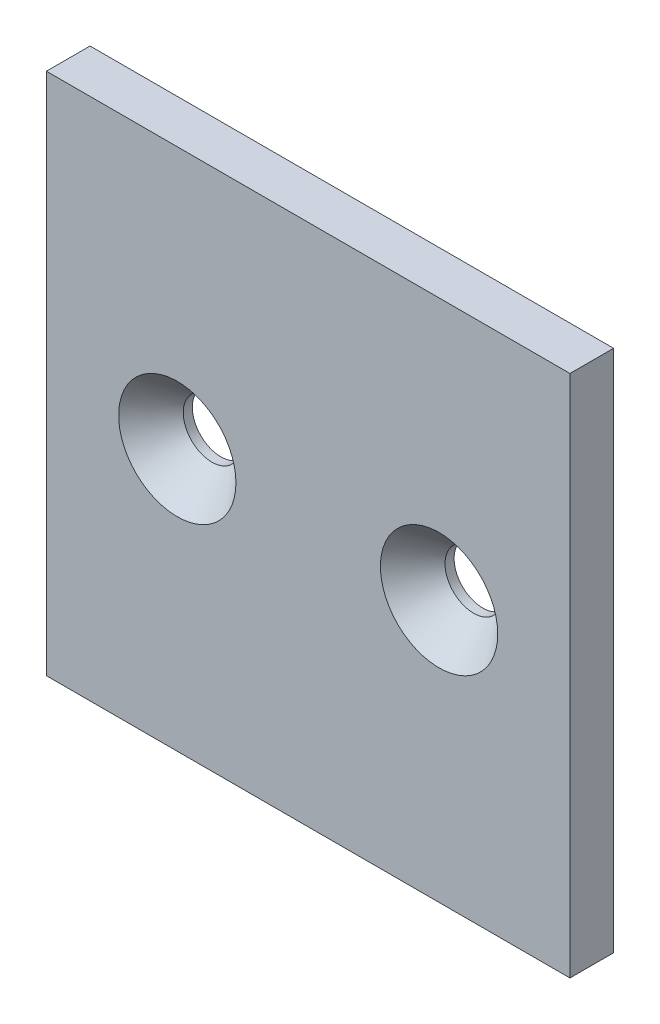
from build123d import *

# Parameters (mm, degrees)
SKETCH1_W                    = 76.2
SKETCH1_H                    = 76.2
SKETCH1_R                    = 4.1656
BOSS_EXTRUDE1_DEPTH          = 3.175
CUT_EXTRUDE1_START           = -5.0292
SKETCH2_R                    = 4.1656
CUT_EXTRUDE1_DEPTH           = 113.9792
CUT_EXTRUDE1_DRAFT           = -41
CUT_EXTRUDE1_PROFILE_2_DEPTH = 113.9792
CUT_EXTRUDE1_PROFILE_2_DRAFT = -41


with BuildPart() as part:
    # Sketch1 → Boss-Extrude1 (new, symmetric)
    with BuildSketch(Plane.XY):
        with Locations((38.1, 38.1)):
            Rectangle(SKETCH1_W, SKETCH1_H)
        with Locations((19.05, 38.1)):
            Circle(SKETCH1_R, mode=Mode.SUBTRACT)
        with Locations((57.15, 38.1)):
            Circle(SKETCH1_R, mode=Mode.SUBTRACT)
    extrude(amount=BOSS_EXTRUDE1_DEPTH, both=True)


with BuildPart() as cut_extrude1_tool:
    # Sketch2 → Cut-Extrude1 (with draft: the straight prism first)
    with BuildSketch(Plane.XY.offset(3.175).offset(CUT_EXTRUDE1_START)):
        with Locations((19.05, 38.1)):
            Circle(SKETCH2_R)
    extrude(amount=CUT_EXTRUDE1_DEPTH)
    # Cut-Extrude1: the draft: its side faces are tilted about the plane it starts from
    cut_extrude1_sides = [cut_extrude1_tool.faces().sort_by_distance(p)[0] for p in [
        (14.8844, 38.1, 55.1354),
    ]]
    draft(cut_extrude1_sides, Plane.XY.offset(3.175).offset(CUT_EXTRUDE1_START), CUT_EXTRUDE1_DRAFT)


with BuildPart() as part_1:
    add(part.part)

    # Cut-Extrude1: cut by cut_extrude1_tool
    add(cut_extrude1_tool.part, mode=Mode.SUBTRACT)


with BuildPart() as cut_extrude1_profile_2_tool:
    # Sketch2 → Cut-Extrude1 profile 2 (with draft: the straight prism first)
    with BuildSketch(Plane.XY.offset(3.175).offset(CUT_EXTRUDE1_START)):
        with Locations((57.15, 38.1)):
            Circle(SKETCH2_R)
    extrude(amount=CUT_EXTRUDE1_PROFILE_2_DEPTH)
    # Cut-Extrude1 profile 2: the draft: its side faces are tilted about the plane it starts from
    cut_extrude1_profile_2_sides = [cut_extrude1_profile_2_tool.faces().sort_by_distance(p)[0] for p in [
        (52.9844, 38.1, 55.1354),
    ]]
    draft(cut_extrude1_profile_2_sides, Plane.XY.offset(3.175).offset(CUT_EXTRUDE1_START), CUT_EXTRUDE1_PROFILE_2_DRAFT)


with BuildPart() as part_2:
    add(part_1.part)

    # Cut-Extrude1 profile 2: cut by cut_extrude1_profile_2_tool
    add(cut_extrude1_profile_2_tool.part, mode=Mode.SUBTRACT)


solid = part_2.part
